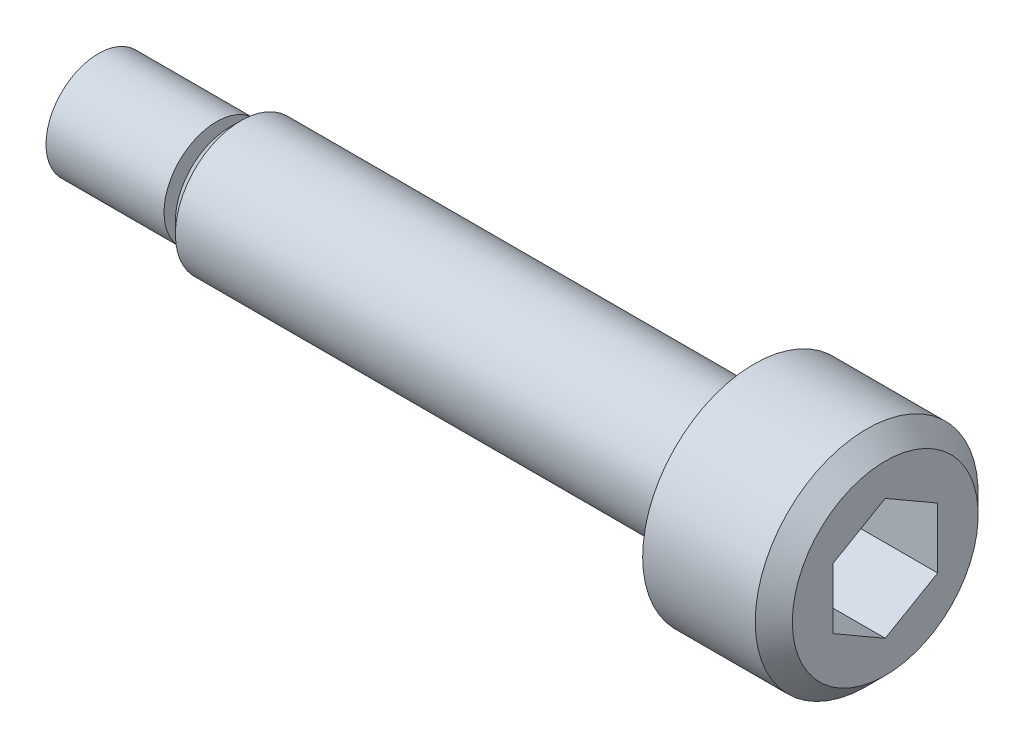
from build123d import *

# Parameters (mm, degrees)
CUT_EXTRUDE_1_DEPTH = 4


with BuildPart() as part:
    # 草图1 → 旋转1 (revolve)
    with BuildSketch(Plane.XY):
        Polygon((-5, 0), (-5, 2), (-0.5, 2), (-0.5, 1.3), (0, 1.3), (0, 2.067), (0.433, 2.5), (20, 2.5), (20, 4.25), (24.292893219, 4.25), (25, 3.542893219), (25, 0), align=None)
    revolve(axis=Axis((25, 0, 0), (-1, 0, 0)))

    # 草图2 → 切除-旋转1 (revolve, cut)
    with BuildSketch(Plane.XY):
        Polygon((19.845299462, 0), (21, 2), (25, 2), (25, 0), align=None)
    revolve(axis=Axis((25, 0, 0), (-1, 0, 0)), mode=Mode.SUBTRACT)

    # 草图3 → 切除-拉伸1 (cut)
    with BuildSketch(Plane(origin=(25, 0, 0), x_dir=(0, 0, -1), z_dir=(1, 0, 0))):
        Polygon((-2, 1.154700538), (-2, -1.154700538), (0, -2.309401077), (2, -1.154700538), (2, 1.154700538), (0, 2.309401077), align=None)
    extrude(amount=-CUT_EXTRUDE_1_DEPTH, mode=Mode.SUBTRACT)


solid = part.part
